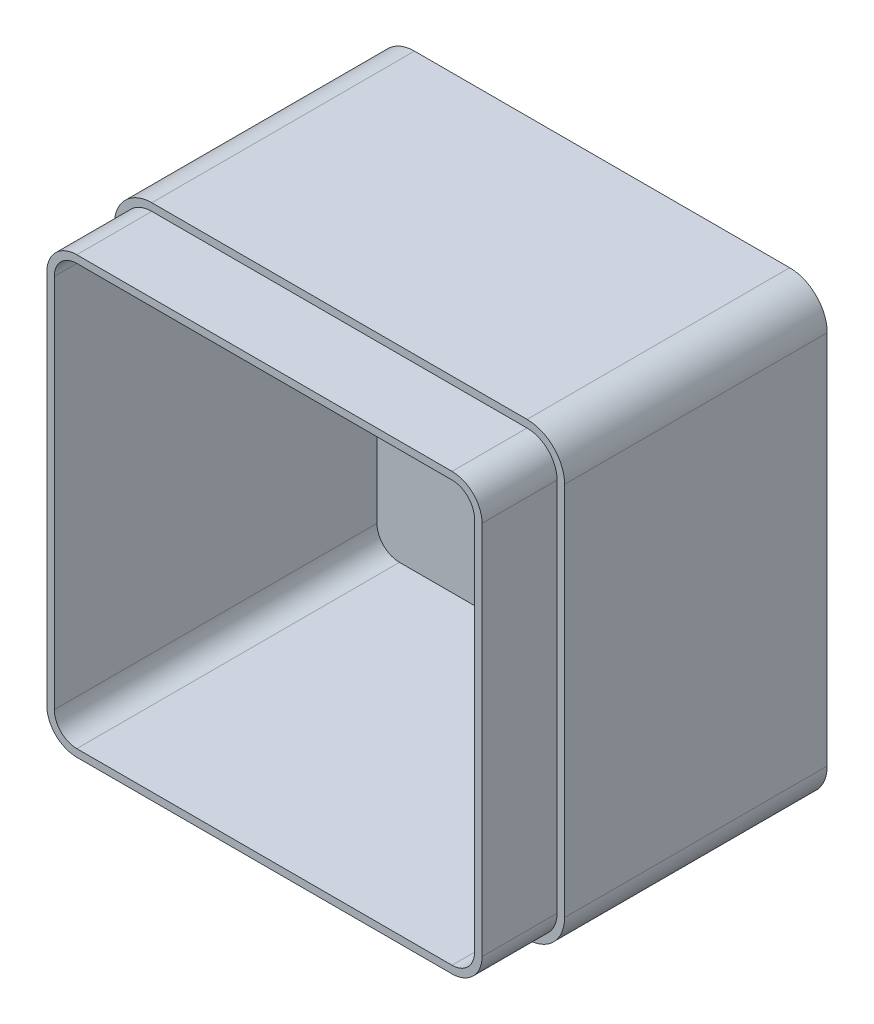
from build123d import *

# Parameters (mm, degrees)
SKETCH_1_W          = 120
SKETCH_1_H          = 120
EXTRUDE_1_DEPTH     = 90
FILLET_1_R          = 10
SHELL_1_T           = -4
CUT_EXTRUDE_1_DEPTH = 20


with BuildPart() as part:
    # Эскиз1 → Бобышка-Вытянуть1 (new body)
    with BuildSketch(Plane.XY):
        with Locations((60, 60)):
            Rectangle(SKETCH_1_W, SKETCH_1_H)
    extrude(amount=EXTRUDE_1_DEPTH)

    # Скругление1
    fillet_1_edges = [part.edges().sort_by_distance(p)[0] for p in [
        (0, 120, 45),
        (120, 120, 45),
        (120, 0, 45),
        (0, 0, 45),
    ]]
    fillet(fillet_1_edges, radius=FILLET_1_R)

    # Оболочка1
    shell_1_openings = [part.faces().sort_by_distance(p)[0] for p in [
        (60, 60, 90),
    ]]
    offset(amount=SHELL_1_T, openings=shell_1_openings, kind=Kind.INTERSECTION)

    # Эскиз2 → Вырез-Вытянуть1 (cut)
    with BuildSketch(Plane.XY.offset(90)):
        with BuildLine():
            Line((120, 10), (120, 110))
            ThreePointArc((120, 110), (117.071067812, 117.071067812), (110, 120))
            Line((110, 120), (10, 120))
            ThreePointArc((10, 120), (2.928932188, 117.071067812), (0, 110))
            Line((0, 110), (0, 10))
            ThreePointArc((0, 10), (2.928932188, 2.928932188), (10, 0))
            Line((10, 0), (110, 0))
            ThreePointArc((110, 0), (117.071067812, 2.928932188), (120, 10))
        make_face()
        with BuildLine():
            Line((118, 10), (118, 110))
            ThreePointArc((118, 110), (115.656854249, 115.656854249), (110, 118))
            Line((110, 118), (10, 118))
            ThreePointArc((10, 118), (4.343145751, 115.656854249), (2, 110))
            Line((2, 110), (2, 10))
            ThreePointArc((2, 10), (4.343145751, 4.343145751), (10, 2))
            Line((10, 2), (110, 2))
            ThreePointArc((110, 2), (115.656854249, 4.343145751), (118, 10))
        make_face(mode=Mode.SUBTRACT)
    extrude(amount=-CUT_EXTRUDE_1_DEPTH, mode=Mode.SUBTRACT)


solid = part.part
